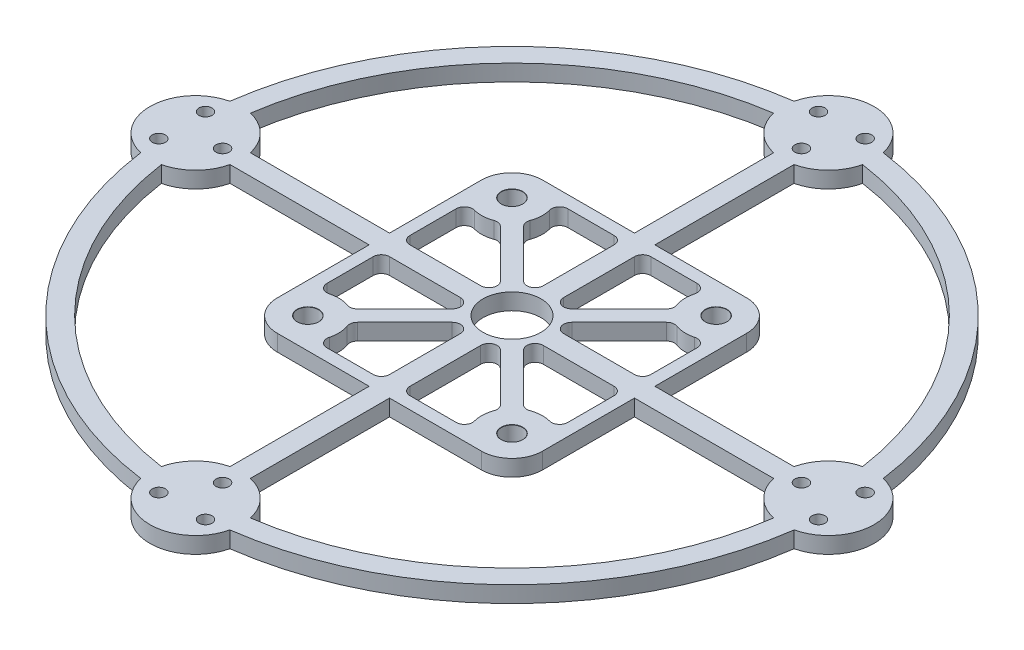
from build123d import *

# Parameters (mm, degrees)
SKETCH1_W                      = 32.5
SKETCH1_H                      = 32.5
BOSS_EXTRUDE1_DEPTH            = 1
M2_CLEARANCE_HOLE1_D           = 2.6
M2_CLEARANCE_HOLE1_CSINK_D     = 2.65
M2_CLEARANCE_HOLE1_CSINK_ANGLE = 90
SKETCH7_R                      = 0.8
BOSS_EXTRUDE2_DEPTH            = 2
CIRPATTERN1_COUNT              = 4
BOSS_EXTRUDE3_DEPTH            = 2
CIRPATTERN3_COUNT              = 4
CUT_EXTRUDE2_DEPTH             = 63.752250956
CIRPATTERN4_COUNT              = 4
FILLET2_R                      = 1
CUT_EXTRUDE3_DEPTH             = 63.752250956
CUT_EXTRUDE3_DEPTH_BACK        = 63.752250956
SKETCH15_R                     = 3.554540671
FILLET1_R                      = 3.75


with BuildPart() as part:
    # Sketch1 → Boss-Extrude1 (new, symmetric)
    with BuildSketch(Plane(origin=(0, 0, 0), x_dir=(1, 0, 0), z_dir=(0, 1, 0))):
        Rectangle(SKETCH1_W, SKETCH1_H)
    extrude(amount=BOSS_EXTRUDE1_DEPTH, both=True)

    # M2 Clearance Hole1 (through all)
    with Locations(Plane(origin=(0, 1, 0), x_dir=(1, 0, 0), z_dir=(0, 1, 0))):
        with Locations((-12.5, -12.5), (-12.5, 12.5), (12.5, -12.5), (12.5, 12.5)):
            CounterSinkHole(M2_CLEARANCE_HOLE1_D / 2, M2_CLEARANCE_HOLE1_CSINK_D / 2, counter_sink_angle=M2_CLEARANCE_HOLE1_CSINK_ANGLE)

    # Sketch7 → Boss-Extrude2 (add)
    with BuildSketch(Plane.XZ.offset(1)):
        with BuildLine():
            Line((16.25, -1.25), (33.291291362, -1.25))
            ThreePointArc((33.291291362, -1.25), (44.35, 0), (33.291291362, 1.25))
            Line((33.291291362, 1.25), (16.25, 1.25))
            Line((16.25, 1.25), (16.25, -1.25))
        make_face()
        with Locations(Location((40.4, 2.857883832, 0), (0, 0, 270))):
            Circle(SKETCH7_R, mode=Mode.SUBTRACT)
        with Locations(Location((40.4, -2.857883832, 0), (0, 0, 270))):
            Circle(SKETCH7_R, mode=Mode.SUBTRACT)
        with Locations(Location((35.45, 0, 0), (0, 0, 270))):
            Circle(SKETCH7_R, mode=Mode.SUBTRACT)
    boss_extrude2 = extrude(amount=-BOSS_EXTRUDE2_DEPTH)

    # CirPattern1: Boss-Extrude2 ×4 about axis
    cirpattern1_axis = Axis((0, 0, 0), (0, 1, 0))
    for i in range(1, CIRPATTERN1_COUNT):
        add(boss_extrude2.rotate(cirpattern1_axis, i * 360 / CIRPATTERN1_COUNT))

    # Sketch13 → Boss-Extrude3 (add)
    with BuildSketch(Plane.XZ.offset(1)):
        with BuildLine():
            ThreePointArc((-5.45586778, -37.487658222), (-26.787039891, -26.787039891), (-37.487658222, -5.45586778))
            ThreePointArc((-37.487658222, -5.45586778), (-38.75, -5.6), (-40.012341778, -5.45586778))
            ThreePointArc((-40.012341778, -5.45586778), (-28.554806844, -28.554806844), (-5.45586778, -40.012341778))
            ThreePointArc((-5.45586778, -40.012341778), (-5.6, -38.75), (-5.45586778, -37.487658222))
        make_face()
    boss_extrude3 = extrude(amount=-BOSS_EXTRUDE3_DEPTH)

    # CirPattern3: Boss-Extrude3 ×4 about axis
    cirpattern3_axis = Axis((0, 0, 0), (0, -1, 0))
    for i in range(1, CIRPATTERN3_COUNT):
        add(boss_extrude3.rotate(cirpattern3_axis, i * 360 / CIRPATTERN3_COUNT))

    # Sketch14 → Cut-Extrude2 (cut, symmetric)
    with BuildSketch(Plane(origin=(0, 1, 0), x_dir=(1, 0, 0), z_dir=(0, 1, 0))):
        with BuildLine():
            Line((-14.75, -1.25), (-14.75, -9.5))
            ThreePointArc((-14.75, -9.5), (-12.739903071, -8.757681666), (-10.651475744, -9.237262181))
            Line((-10.651475744, -9.237262181), (-2.664213562, -1.25))
            Line((-2.664213562, -1.25), (-14.75, -1.25))
        make_face()
        with BuildLine():
            Line((-1.25, -14.75), (-1.25, -2.664213562))
            Line((-1.25, -2.664213562), (-9.237262181, -10.651475744))
            ThreePointArc((-9.237262181, -10.651475744), (-8.757681666, -12.739903071), (-9.5, -14.75))
            Line((-9.5, -14.75), (-1.25, -14.75))
        make_face()
    cut_extrude2 = extrude(amount=CUT_EXTRUDE2_DEPTH, both=True, mode=Mode.SUBTRACT)

    # CirPattern4: Cut-Extrude2 ×4 about axis
    cirpattern4_axis = Axis((0, 0, 0), (0, 1, 0))
    for i in range(1, CIRPATTERN4_COUNT):
        add(cut_extrude2.rotate(cirpattern4_axis, i * 360 / CIRPATTERN4_COUNT), mode=Mode.SUBTRACT)

    # Fillet2
    fillet2_edges = [part.edges().sort_by_distance(p)[0] for p in [
        (1.25, 0, 14.75),
        (9.5, 0, 14.75),
        (9.237262181, 0, 10.651475744),
        (1.25, 0, 2.664213562),
        (10.651475744, 0, 9.237262181),
        (14.75, 0, 9.5),
        (14.75, 0, 1.25),
        (2.664213562, 0, 1.25),
        (14.75, 0, -1.25),
        (9.237262181, 0, -10.651475744),
        (1.25, 0, -2.664213562),
        (2.664213562, 0, -1.25),
        (10.651475744, 0, -9.237262181),
        (14.75, 0, -9.5),
        (9.5, 0, -14.75),
        (1.25, 0, -14.75),
        (-10.651475744, 0, 9.237262181),
        (-2.664213562, 0, -1.25),
        (-9.237262181, 0, -10.651475744),
        (-1.25, 0, 14.75),
        (-14.75, 0, 9.5),
        (-14.75, 0, 1.25),
        (-9.237262181, 0, 10.651475744),
        (-9.5, 0, 14.75),
        (-10.651475744, 0, -9.237262181),
        (-1.25, 0, 2.664213562),
        (-2.664213562, 0, 1.25),
        (-1.25, 0, -14.75),
        (-14.75, 0, -1.25),
        (-1.25, 0, -2.664213562),
        (-14.75, 0, -9.5),
        (-9.5, 0, -14.75),
    ]]
    fillet(fillet2_edges, radius=FILLET2_R)

    # Sketch15 → Cut-Extrude3 (cut, two sides: drawn at the far end of the back side and taken through both)
    with BuildSketch(Plane(origin=(0, 1, 0), x_dir=(1, 0, 0), z_dir=(0, 1, 0)).offset(-CUT_EXTRUDE3_DEPTH_BACK)):
        with Locations(Location((0, 0, 0), (0, 0, 270))):
            Circle(SKETCH15_R)
    extrude(amount=CUT_EXTRUDE3_DEPTH + CUT_EXTRUDE3_DEPTH_BACK, mode=Mode.SUBTRACT)

    # Fillet1
    fillet1_edges = [part.edges().sort_by_distance(p)[0] for p in [
        (-16.25, 0, -16.25),
        (16.25, 0, -16.25),
        (16.25, 0, 16.25),
        (-16.25, 0, 16.25),
    ]]
    fillet(fillet1_edges, radius=FILLET1_R)


solid = part.part
